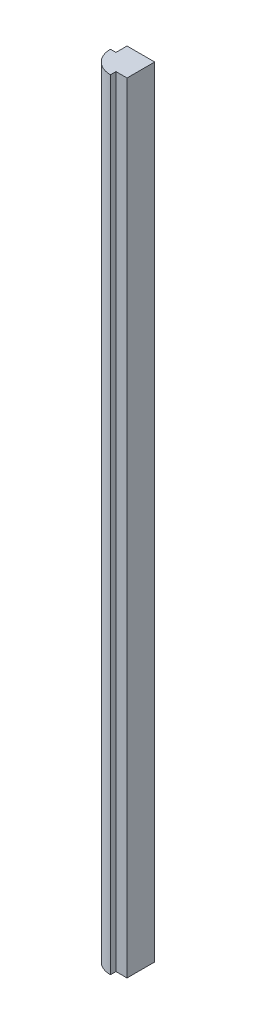
from build123d import *

# Parameters (mm, degrees)
BOSS_EXTRUDE1_DEPTH = 447.04


with BuildPart() as part:
    # Sketch1 → Boss-Extrude1 (new body)
    with BuildSketch(Plane(origin=(0, 0, 0), x_dir=(1, 0, 0), z_dir=(0, 1, 0))):
        with BuildLine():
            ThreePointArc((0, 12.7), (3.719743879, 3.719743879), (12.7, 0))
            Line((12.7, 0), (12.7, 3.175))
            Line((12.7, 3.175), (19.05, 3.175))
            Line((19.05, 3.175), (19.05, 19.05))
            Line((19.05, 19.05), (3.175, 19.05))
            Line((3.175, 19.05), (3.175, 12.7))
            Line((3.175, 12.7), (0, 12.7))
        make_face()
    extrude(amount=BOSS_EXTRUDE1_DEPTH)


solid = part.part
